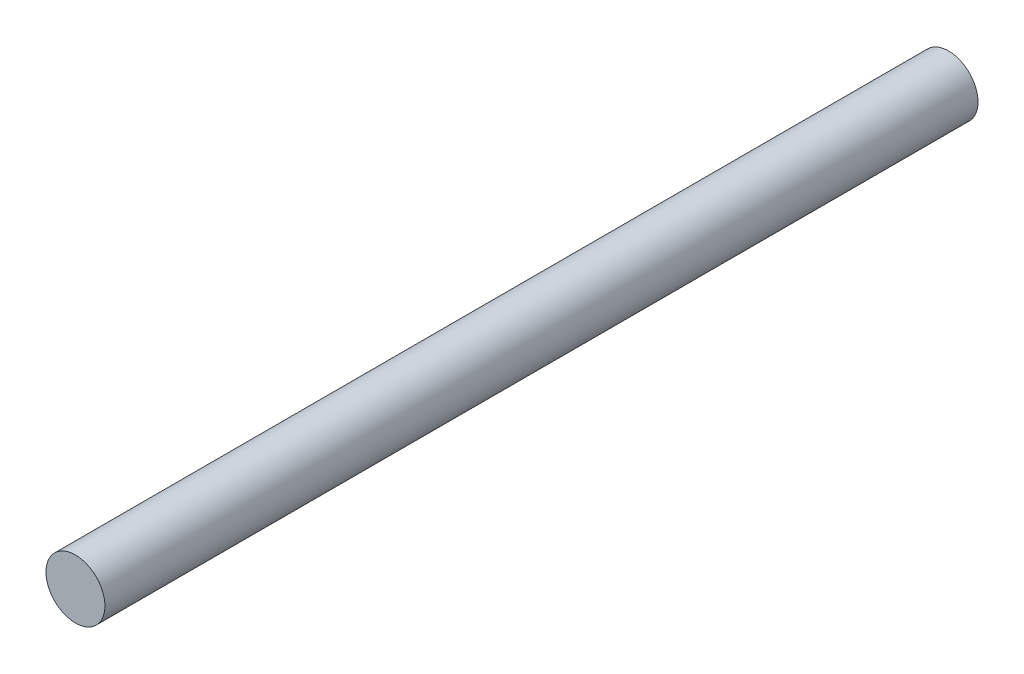
from build123d import *

# Parameters (mm, degrees)
ESBO_O1_R                = 3.175
RESSALTO_EXTRUS_O1_DEPTH = 94


with BuildPart() as part:
    # Esboço1 → Ressalto-extrusão1 (new body)
    with BuildSketch(Plane.XY):
        Circle(ESBO_O1_R)
    extrude(amount=RESSALTO_EXTRUS_O1_DEPTH)


solid = part.part
